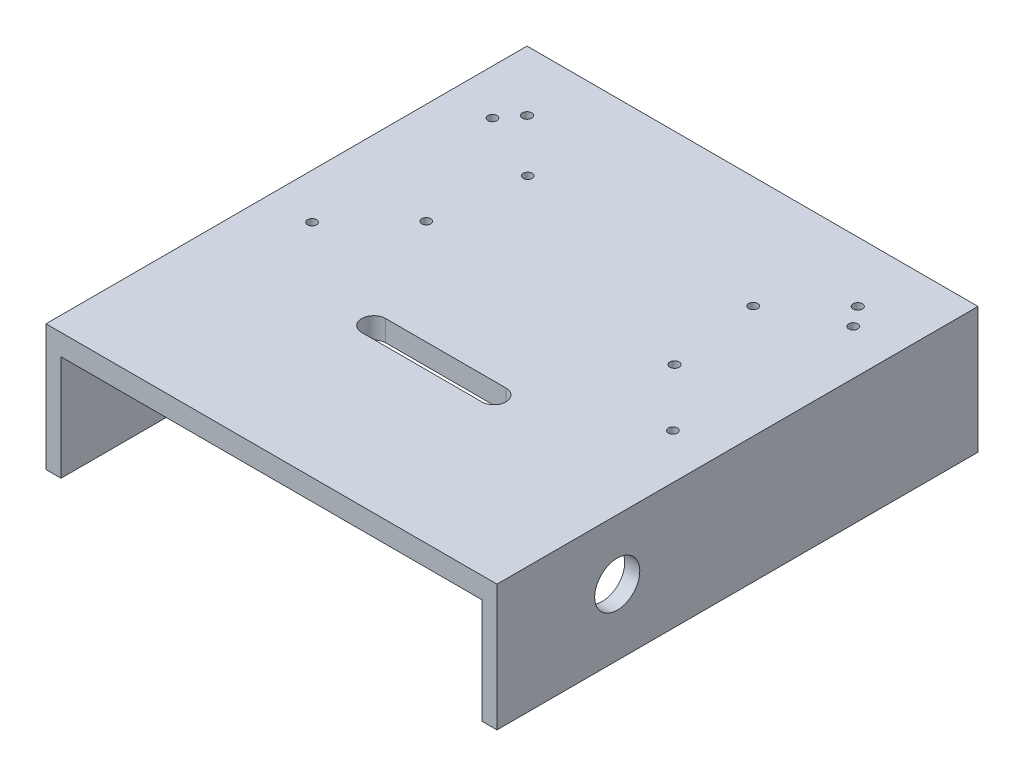
from build123d import *

# Parameters (mm, degrees)
BOSS_EXTRUDE1_DEPTH = 160
CUT_EXTRUDE1_DEPTH  = 32
SKETCH3_R           = 7.5
CUT_EXTRUDE2_DEPTH  = 210
SKETCH5_R           = 1.5
CUT_EXTRUDE4_DEPTH  = 210
CUT_EXTRUDE6_DEPTH  = 20
SKETCH8_R           = 1.55
CUT_EXTRUDE7_DEPTH  = 10
SKETCH9_W           = 24
SKETCH9_H           = 12
BOSS_EXTRUDE3_DEPTH = 2
SKETCH10_W          = 3
SKETCH10_H          = 12
BOSS_EXTRUDE4_DEPTH = 25
SKETCH11_R          = 3.5
CUT_EXTRUDE8_DEPTH  = 1
SKETCH12_R          = 1.55
CUT_EXTRUDE9_DEPTH  = 3
SKETCH13_R          = 1.5
SKETCH13_R_2        = 1.55
CUT_EXTRUDE10_DEPTH = 10
SKETCH14_R          = 1.375
BOSS_EXTRUDE5_DEPTH = 5


with BuildPart() as part:
    # Sketch1 → Boss-Extrude1 (new body)
    with BuildSketch(Plane.XY):
        Polygon((-95.061728395, -14.551440329), (-95.061728395, 27.448559671), (54.938271605, 27.448559671), (54.938271605, -14.551440329), (49.938271605, -14.551440329), (49.938271605, 20.448559671), (-90.061728395, 20.448559671), (-90.061728395, -14.551440329), align=None)
    extrude(amount=BOSS_EXTRUDE1_DEPTH)

    # Sketch2 → Cut-Extrude1 (cut)
    with BuildSketch(Plane(origin=(0, 0, 0), x_dir=(-1, 0, 0), z_dir=(0, 0, -1))):
        with BuildLine():
            Line((-50.938271605, 15.448559671), (-50.938271605, -4.551440329))
            ThreePointArc((-50.938271605, -4.551440329), (-52.438271605, -6.051440329), (-53.938271605, -4.551440329))
            Line((-53.938271605, -4.551440329), (-53.938271605, 15.448559671))
            ThreePointArc((-53.938271605, 15.448559671), (-52.438271605, 16.948559671), (-50.938271605, 15.448559671))
        make_face()
        with BuildLine():
            Line((-4.938271605, 25.448559671), (45.061728395, 25.448559671))
            ThreePointArc((45.061728395, 25.448559671), (46.561728395, 23.948559671), (45.061728395, 22.448559671))
            Line((45.061728395, 22.448559671), (-4.938271605, 22.448559671))
            ThreePointArc((-4.938271605, 22.448559671), (-6.438271605, 23.948559671), (-4.938271605, 25.448559671))
        make_face()
        with BuildLine():
            Line((94.061728395, 15.448559671), (94.061728395, -4.551440329))
            ThreePointArc((94.061728395, -4.551440329), (92.561728395, -6.051440329), (91.061728395, -4.551440329))
            Line((91.061728395, -4.551440329), (91.061728395, 15.448559671))
            ThreePointArc((91.061728395, 15.448559671), (92.561728395, 16.948559671), (94.061728395, 15.448559671))
        make_face()
    extrude(amount=-CUT_EXTRUDE1_DEPTH, mode=Mode.SUBTRACT)

    # Sketch3 → Cut-Extrude2 (cut)
    with BuildSketch(Plane.ZY.offset(95.061728395)):
        with Locations((120, 7.448559671)):
            Circle(SKETCH3_R)
    extrude(amount=-CUT_EXTRUDE2_DEPTH, mode=Mode.SUBTRACT)

    # Sketch5 → Cut-Extrude4 (cut)
    with BuildSketch(Plane(origin=(0, 27.448559671, 0), x_dir=(1, 0, 0), z_dir=(0, 1, 0))):
        with Locations(Location((-80.061728395, -26.5, 0), (0, 0, 180))):
            Circle(SKETCH5_R)
        with Locations(Location((39.938271605, -26.5, 0), (0, 0, 180))):
            Circle(SKETCH5_R)
        with Locations(Location((-80.061728395, -86.5, 0), (0, 0, 180))):
            Circle(SKETCH5_R)
        with Locations(Location((39.938271605, -86.5, 0), (0, 0, 180))):
            Circle(SKETCH5_R)
    extrude(amount=-CUT_EXTRUDE4_DEPTH, mode=Mode.SUBTRACT)

    # Sketch7 → Cut-Extrude6 (cut)
    with BuildSketch(Plane(origin=(0, 27.448559671, 0), x_dir=(1, 0, 0), z_dir=(0, 1, 0))):
        with BuildLine():
            Line((-40.061728395, -102), (-0.061728395, -102))
            ThreePointArc((-0.061728395, -102), (3.938271605, -106), (-0.061728395, -110))
            Line((-0.061728395, -110), (-40.061728395, -110))
            ThreePointArc((-40.061728395, -110), (-44.061728395, -106), (-40.061728395, -102))
        make_face()
    extrude(amount=-CUT_EXTRUDE6_DEPTH, mode=Mode.SUBTRACT)

    # Sketch8 → Cut-Extrude7 (cut)
    with BuildSketch(Plane(origin=(0, 27.448559671, 0), x_dir=(1, 0, 0), z_dir=(0, 1, 0))):
        with Locations(Location((-75.061728395, -20, 0), (0, 0, 180))):
            Circle(SKETCH8_R)
        with Locations(Location((34.938271605, -20, 0), (0, 0, 180))):
            Circle(SKETCH8_R)
    extrude(amount=-CUT_EXTRUDE7_DEPTH, mode=Mode.SUBTRACT)

    # Sketch9 → Boss-Extrude3 (add)
    with BuildSketch(Plane.XZ.offset(-20.448559671)):
        with Locations((37.938271605, 100)):
            Rectangle(SKETCH9_W, SKETCH9_H)
    boss_extrude3 = extrude(amount=BOSS_EXTRUDE3_DEPTH)

    # Sketch10 → Boss-Extrude4 (add)
    with BuildSketch(Plane.XZ.offset(-18.448559671)):
        with Locations((27.438271605, 100)):
            Rectangle(SKETCH10_W, SKETCH10_H)
    boss_extrude4 = extrude(amount=BOSS_EXTRUDE4_DEPTH)

    # Sketch11 → Cut-Extrude8 (cut)
    with BuildSketch(Plane.ZY.offset(-25.938271605)):
        with Locations(Location((100, 15.948559671, 0), (0, 0, 270))):
            Circle(SKETCH11_R)
        with Locations(Location((100, -2.051440329, 0), (0, 0, 270))):
            Circle(SKETCH11_R)
    cut_extrude8 = extrude(amount=-CUT_EXTRUDE8_DEPTH, mode=Mode.SUBTRACT)

    # Sketch12 → Cut-Extrude9 (cut)
    with BuildSketch(Plane.ZY.offset(-26.938271605)):
        with Locations(Location((100, 15.948559671, 0), (0, 0, 270))):
            Circle(SKETCH12_R)
        with Locations(Location((100, -2.051440329, 0), (0, 0, 270))):
            Circle(SKETCH12_R)
    cut_extrude9 = extrude(amount=-CUT_EXTRUDE9_DEPTH, mode=Mode.SUBTRACT)

    # Mirror1: Boss-Extrude3, Boss-Extrude4, Cut-Extrude8, Cut-Extrude9 across plane
    add(boss_extrude3.mirror(Plane.ZY.offset(20.061728395)))
    add(boss_extrude4.mirror(Plane.ZY.offset(20.061728395)))
    add(cut_extrude8.mirror(Plane.ZY.offset(20.061728395)), mode=Mode.SUBTRACT)
    add(cut_extrude9.mirror(Plane.ZY.offset(20.061728395)), mode=Mode.SUBTRACT)

    # Sketch13 → Cut-Extrude10 (cut)
    with BuildSketch(Plane(origin=(0, 27.448559671, 0), x_dir=(1, 0, 0), z_dir=(0, 1, 0))):
        with Locations(Location((17.438271605, -37.265826534, 0), (0, 0, 180))):
            Circle(SKETCH13_R)
        with Locations(Location((-57.561728395, -37.265826534, 0), (0, 0, 180))):
            Circle(SKETCH13_R)
        with Locations(Location((-61.341728395, -67.223803809, 0), (0, 0, 180))):
            Circle(SKETCH13_R)
        with Locations(Location((21.218271605, -67.223803809, 0), (0, 0, 180))):
            Circle(SKETCH13_R_2)
    extrude(amount=-CUT_EXTRUDE10_DEPTH, mode=Mode.SUBTRACT)

    # Sketch14 → Boss-Extrude5 (add)
    # profile 1 of 2: a face of its own
    with BuildSketch(Plane.XZ.offset(-20.448559671)):
        with BuildLine():
            Line((5.139369782, 81.650400065), (5.139369782, 56.650400065))
            ThreePointArc((5.139369782, 56.650400065), (2.139369782, 53.650400065), (-0.860630218, 56.650400065))
            Line((-0.860630218, 56.650400065), (-0.860630218, 81.650400065))
            ThreePointArc((-0.860630218, 81.650400065), (2.139369782, 84.650400065), (5.139369782, 81.650400065))
        make_face()
        with Locations((2.139369782, 69.150400065)):
            Circle(SKETCH14_R, mode=Mode.SUBTRACT)
    # profile 2 of 2: a face of its own
    with BuildSketch(Plane.XZ.offset(-20.448559671)):
        with BuildLine():
            Line((-36.860630218, 81.650400065), (-36.860630218, 56.650400065))
            ThreePointArc((-36.860630218, 56.650400065), (-39.860630218, 53.650400065), (-42.860630218, 56.650400065))
            Line((-42.860630218, 56.650400065), (-42.860630218, 81.650400065))
            ThreePointArc((-42.860630218, 81.650400065), (-39.860630218, 84.650400065), (-36.860630218, 81.650400065))
        make_face()
        with Locations((-39.860630218, 69.150400065)):
            Circle(SKETCH14_R, mode=Mode.SUBTRACT)
    extrude(amount=BOSS_EXTRUDE5_DEPTH)


solid = part.part
